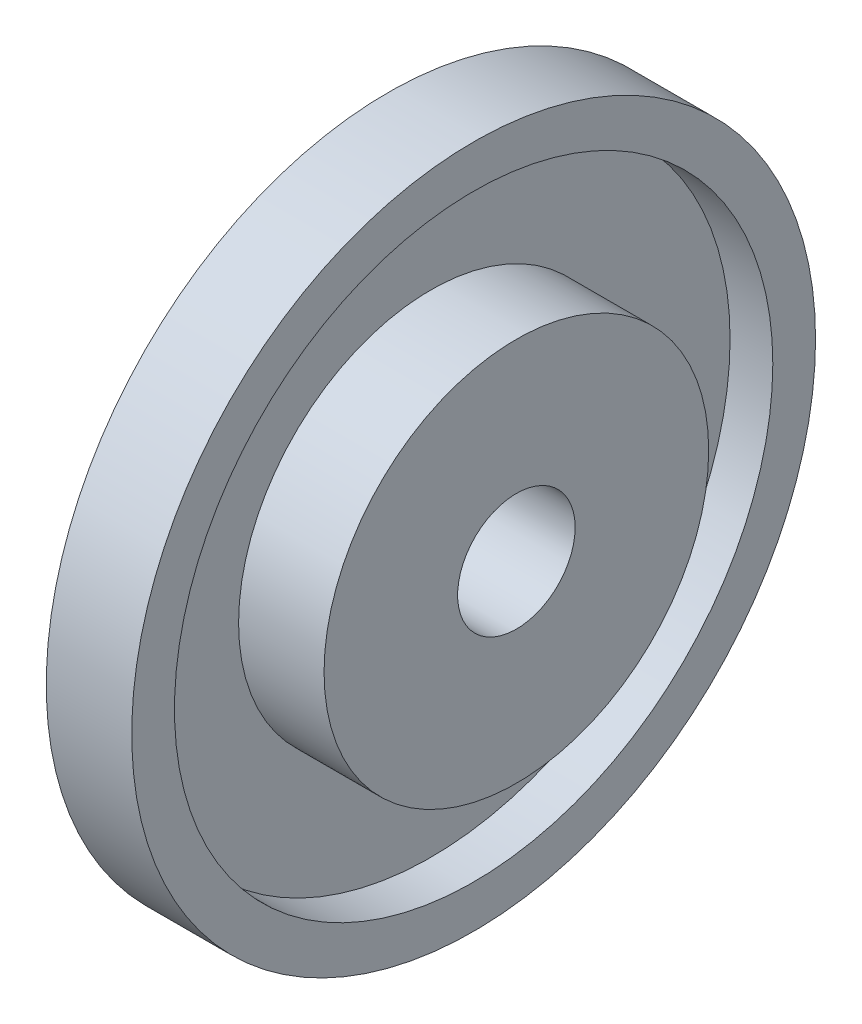
from build123d import *

# Parameters (mm, degrees)
SKETCH_1_R      = 14
SKETCH_1_R_2    = 9
EXTRUDE_1_DEPTH = 2
SKETCH_1_3_R    = 16
SKETCH_1_3_R_2  = 14
EXTRUDE_2_DEPTH = 4
SKETCH_1_4_R    = 9
SKETCH_1_4_R_2  = 2.75
EXTRUDE_3_DEPTH = 6
CHAMFER_1_SIZE  = 2
CHAMFER_1_SIZE2 = 3.464101615


with BuildPart() as part:
    # 草图1 → 凸台-拉伸1 (new body)
    with BuildSketch(Plane(origin=(0, 0, 0), x_dir=(0, 0, -1), z_dir=(1, 0, 0))):
        Circle(SKETCH_1_R)
        Circle(SKETCH_1_R_2, mode=Mode.SUBTRACT)
    extrude(amount=EXTRUDE_1_DEPTH)

    # 草图1<3> → 凸台-拉伸2 (add)
    with BuildSketch(Plane(origin=(0, 0, 0), x_dir=(0, 0, -1), z_dir=(1, 0, 0))):
        Circle(SKETCH_1_3_R)
        Circle(SKETCH_1_3_R_2, mode=Mode.SUBTRACT)
    extrude(amount=EXTRUDE_2_DEPTH)

    # 草图1<4> → 凸台-拉伸3 (add)
    with BuildSketch(Plane(origin=(0, 0, 0), x_dir=(0, 0, -1), z_dir=(1, 0, 0))):
        Circle(SKETCH_1_4_R)
        Circle(SKETCH_1_4_R_2, mode=Mode.SUBTRACT)
    extrude(amount=EXTRUDE_3_DEPTH)

    # 倒角1
    chamfer_1_edges = [part.edges().sort_by_distance(p)[0] for p in [
        (0, 0, 2.75),
    ]]
    chamfer_1_side = [part.faces().sort_by_distance(p)[0] for p in [
        (3, 0, 2.75),
    ]]
    chamfer(chamfer_1_edges, length=CHAMFER_1_SIZE, length2=CHAMFER_1_SIZE2, reference=chamfer_1_side[0])


solid = part.part
